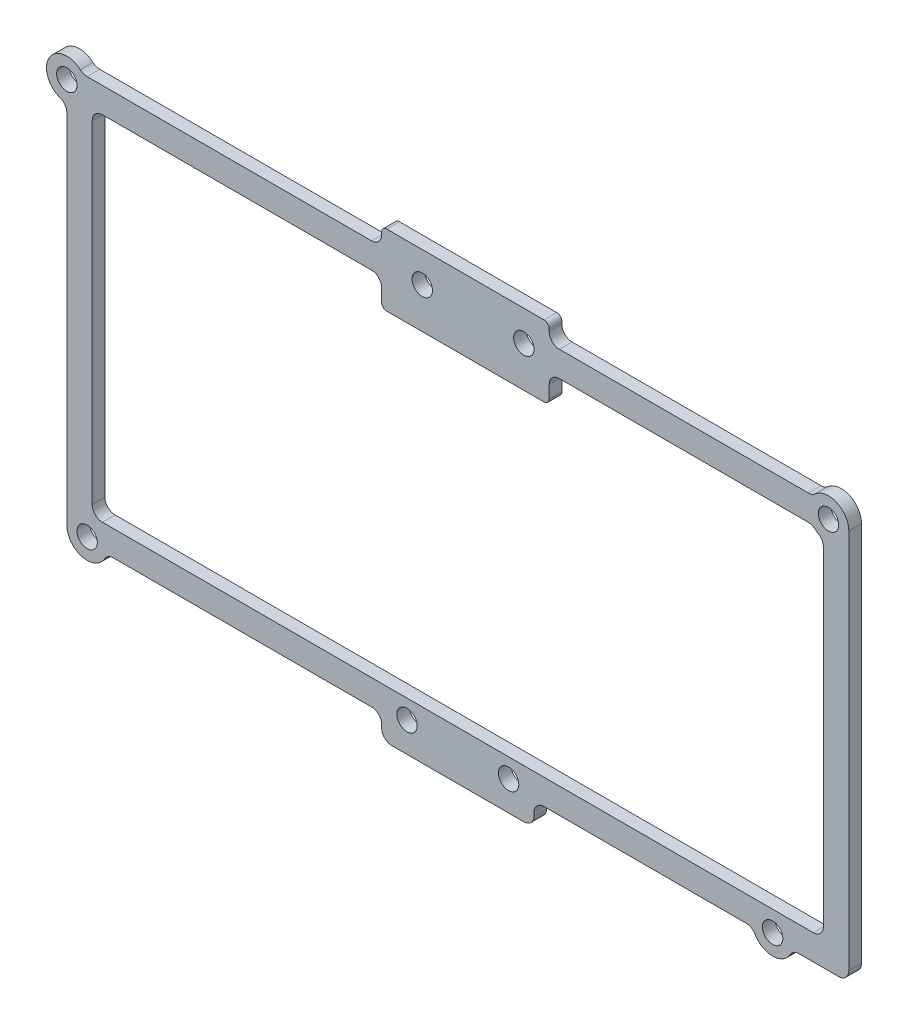
from build123d import *

# Parameters (mm, degrees)
SKETCH1_R           = 2.5527
BOSS_EXTRUDE1_DEPTH = 3.175


with BuildPart() as part:
    # Sketch1 → Boss-Extrude1 (new body)
    with BuildSketch(Plane(origin=(0, 0, 0), x_dir=(-1, 0, 0), z_dir=(0, 0, -1))):
        with BuildLine():
            Line((-73.66, 394.97), (-113.03, 394.97))
            ThreePointArc((-113.03, 394.97), (-113.928025612, 394.598025612), (-114.3, 393.7))
            Line((-114.3, 393.7), (-114.3, 393.065))
            ThreePointArc((-114.3, 393.065), (-115.043948776, 391.268948776), (-116.84, 390.525))
            Line((-116.84, 390.525), (-179.109843752, 390.525))
            ThreePointArc((-179.109843752, 390.525), (-180.007869365, 390.689047559), (-180.789895835, 391.16))
            ThreePointArc((-180.789895835, 391.16), (-186.240104165, 391.980104165), (-189.23, 387.35))
            Line((-189.23, 387.35), (-189.23, 292.1))
            ThreePointArc((-189.23, 292.1), (-188.486051224, 290.303948776), (-186.69, 289.56))
            Line((-186.69, 289.56), (-176.779113577, 289.56))
            ThreePointArc((-176.779113577, 289.56), (-175.509113577, 289.219704526), (-174.579409051, 288.29))
            ThreePointArc((-174.579409051, 288.29), (-170.18, 285.75), (-165.780590949, 288.29))
            ThreePointArc((-165.780590949, 288.29), (-164.850886423, 289.219704526), (-163.580886423, 289.56))
            Line((-163.580886423, 289.56), (-113.03, 289.56))
            ThreePointArc((-113.03, 289.56), (-111.233948776, 288.816051224), (-110.49, 287.02))
            Line((-110.49, 287.02), (-110.49, 286.258))
            ThreePointArc((-110.49, 286.258), (-109.746051224, 284.461948776), (-107.95, 283.718))
            Line((-107.95, 283.718), (-74.93, 283.718))
            ThreePointArc((-74.93, 283.718), (-73.133948776, 284.461948776), (-72.39, 286.258))
            Line((-72.39, 286.258), (-72.39, 287.02))
            ThreePointArc((-72.39, 287.02), (-71.646051224, 288.816051224), (-69.85, 289.56))
            Line((-69.85, 289.56), (-5.329113577, 289.56))
            ThreePointArc((-5.329113577, 289.56), (-4.059113577, 289.219704526), (-3.129409051, 288.29))
            ThreePointArc((-3.129409051, 288.29), (2.584800749, 285.923096802), (6.35, 290.83))
            Line((6.35, 290.83), (6.35, 380.165795103))
            ThreePointArc((6.35, 380.165795103), (6.816098684, 381.632264787), (8.043333333, 382.560530069))
            ThreePointArc((8.043333333, 382.560530069), (10.729754791, 389.923742018), (2.989895835, 391.16))
            ThreePointArc((2.989895835, 391.16), (2.207869365, 390.689047559), (1.309843752, 390.525))
            Line((1.309843752, 390.525), (-69.85, 390.525))
            ThreePointArc((-69.85, 390.525), (-71.646051224, 391.268948776), (-72.39, 393.065))
            Line((-72.39, 393.065), (-72.39, 393.7))
            ThreePointArc((-72.39, 393.7), (-72.761974388, 394.598025612), (-73.66, 394.97))
        make_face()
        with Locations(Location((-184.15, 387.35, 0), (0, 0, 180))):
            Circle(SKETCH1_R, mode=Mode.SUBTRACT)
        with Locations(Location((-107.95, 387.35, 0), (0, 0, 180))):
            Circle(SKETCH1_R, mode=Mode.SUBTRACT)
        with Locations(Location((-82.55, 387.35, 0), (0, 0, 180))):
            Circle(SKETCH1_R, mode=Mode.SUBTRACT)
        with Locations(Location((1.27, 290.83, 0), (0, 0, 180))):
            Circle(SKETCH1_R, mode=Mode.SUBTRACT)
        with Locations(Location((-104.14, 291.1475, 0), (0, 0, 180))):
            Circle(SKETCH1_R, mode=Mode.SUBTRACT)
        with Locations(Location((-78.74, 291.1475, 0), (0, 0, 180))):
            Circle(SKETCH1_R, mode=Mode.SUBTRACT)
        with Locations(Location((6.35, 387.35, 0), (0, 0, 180))):
            Circle(SKETCH1_R, mode=Mode.SUBTRACT)
        with Locations(Location((-170.18, 290.83, 0), (0, 0, 180))):
            Circle(SKETCH1_R, mode=Mode.SUBTRACT)
        with BuildLine():
            Line((-72.39, 378.46), (-72.39, 381.635))
            ThreePointArc((-72.39, 381.635), (-71.646051224, 383.431051224), (-69.85, 384.175))
            Line((-69.85, 384.175), (-2.54, 384.175))
            ThreePointArc((-2.54, 384.175), (-0.743948776, 383.431051224), (0, 381.635))
            Line((0, 381.635), (0, 298.45))
            ThreePointArc((0, 298.45), (-0.743948776, 296.653948776), (-2.54, 295.91))
            Line((-2.54, 295.91), (-180.34, 295.91))
            ThreePointArc((-180.34, 295.91), (-182.136051224, 296.653948776), (-182.88, 298.45))
            Line((-182.88, 298.45), (-182.88, 380.750886423))
            ThreePointArc((-182.88, 380.750886423), (-182.539704526, 382.020886423), (-181.61, 382.950590949))
            ThreePointArc((-181.61, 382.950590949), (-181.185264253, 383.224864614), (-180.789895835, 383.54))
            ThreePointArc((-180.789895835, 383.54), (-180.007869365, 384.010952441), (-179.109843752, 384.175))
            Line((-179.109843752, 384.175), (-116.84, 384.175))
            ThreePointArc((-116.84, 384.175), (-115.043948776, 383.431051224), (-114.3, 381.635))
            Line((-114.3, 381.635), (-114.3, 378.46))
            ThreePointArc((-114.3, 378.46), (-113.928025612, 377.561974388), (-113.03, 377.19))
            Line((-113.03, 377.19), (-73.66, 377.19))
            ThreePointArc((-73.66, 377.19), (-72.761974388, 377.561974388), (-72.39, 378.46))
        make_face(mode=Mode.SUBTRACT)
    extrude(amount=-BOSS_EXTRUDE1_DEPTH)


solid = part.part
